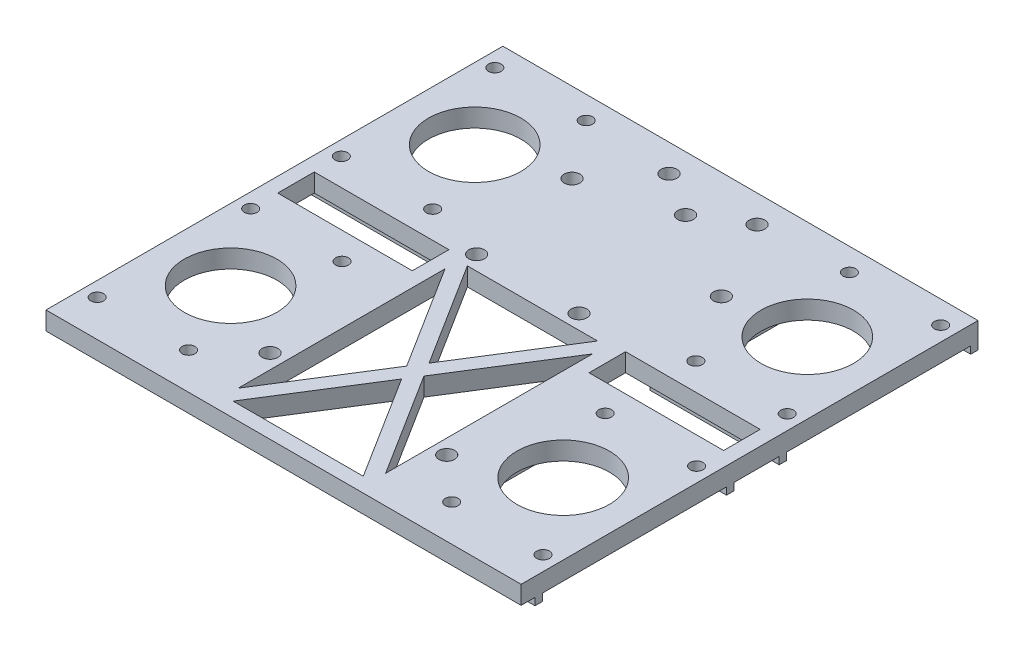
from build123d import *

# Parameters (mm, degrees)
SKETCH1_W                 = 130
SKETCH1_H                 = 125
BOSS_EXTRUDE1_DEPTH       = 5
SKETCH2_R                 = 1.75
SKETCH2_R_2               = 12.65
CUT_EXTRUDE1_DEPTH        = 10
SKETCH4_R                 = 2.15
CUT_EXTRUDE3_DEPTH        = 10
BOSS_EXTRUDE2_DEPTH       = 2
MIRROR7_COPY_1_SKETCH_R   = 1.75
MIRROR7_COPY_1_SKETCH_R_2 = 12.65
MIRROR7_COPY_1_DEPTH      = 10
MIRROR7_COPY_2_DEPTH      = 2
SKETCH10_R                = 2.15
CUT_EXTRUDE8_DEPTH        = 91.311959341
SKETCH11_R                = 2.65
CUT_EXTRUDE9_DEPTH        = 0.5
CUT_EXTRUDE10_DEPTH       = 91.444734507
CUT_EXTRUDE11_DEPTH       = 91.444734507


with BuildPart() as part:
    # Sketch1 → Boss-Extrude1 (new body)
    with BuildSketch(Plane(origin=(0, 0, 0), x_dir=(1, 0, 0), z_dir=(0, 1, 0))):
        Rectangle(SKETCH1_W, SKETCH1_H)
    extrude(amount=BOSS_EXTRUDE1_DEPTH)

    # Sketch2 → Cut-Extrude1 (cut)
    with BuildSketch(Plane(origin=(0, 5, 0), x_dir=(1, 0, 0), z_dir=(0, 1, 0))):
        with Locations(Location((-61, -52.5, 0), (0, 0, 270))):
            Circle(SKETCH2_R)
        with Locations(Location((-36, -52.5, 0), (0, 0, 270))):
            Circle(SKETCH2_R)
        with Locations(Location((-36, -10.5, 0), (0, 0, 270))):
            Circle(SKETCH2_R)
        with Locations(Location((-61, -10.5, 0), (0, 0, 270))):
            Circle(SKETCH2_R)
        with Locations(Location((-45.5, -31.5, 0), (0, 0, 270))):
            Circle(SKETCH2_R_2)
    cut_extrude1 = extrude(amount=-CUT_EXTRUDE1_DEPTH, mode=Mode.SUBTRACT)

    # Mirror3: Cut-Extrude1 across plane
    add(cut_extrude1.mirror(Plane.ZY), mode=Mode.SUBTRACT)

    # Sketch4 → Cut-Extrude3 (cut)
    with BuildSketch(Plane(origin=(0, 5, 0), x_dir=(1, 0, 0), z_dir=(0, 1, 0))):
        with Locations(Location((0, 47.5, 0), (0, 0, 270))):
            Circle(SKETCH4_R)
        with Locations(Location((12.049810205, 55, 0), (0, 0, 270))):
            Circle(SKETCH4_R)
        with Locations(Location((-12.049810205, 55, 0), (0, 0, 270))):
            Circle(SKETCH4_R)
    extrude(amount=-CUT_EXTRUDE3_DEPTH, mode=Mode.SUBTRACT)

    # Sketch5 → Boss-Extrude2 (add)
    with BuildSketch(Plane.XZ):
        Polygon((-65, 58.7), (-65, 56.7), (-31.6, 56.7), (-31.6, 6.3), (-65, 6.3), (-65, 4.3), (-29.6, 4.3), (-29.6, 58.7), align=None)
    boss_extrude2 = extrude(amount=BOSS_EXTRUDE2_DEPTH)

    # Mirror5: Boss-Extrude2 across plane
    add(boss_extrude2.mirror(Plane.ZY))

    # Mirror7: Cut-Extrude1, Boss-Extrude2 across plane
    add(cut_extrude1.mirror(Plane.XY.offset(-1.9)), mode=Mode.SUBTRACT)
    add(boss_extrude2.mirror(Plane.XY.offset(-1.9)))

    # Mirror7 copy 1 sketch → Mirror7 copy 1 (cut)
    with BuildSketch(Plane(origin=(0, 5, -3.8), x_dir=(-1, 0, 0), z_dir=(0, 1, 0))):
        with Locations(Location((-61, -52.5, 0), (0, 0, 270))):
            Circle(MIRROR7_COPY_1_SKETCH_R)
        with Locations(Location((-36, -52.5, 0), (0, 0, 270))):
            Circle(MIRROR7_COPY_1_SKETCH_R)
        with Locations(Location((-36, -10.5, 0), (0, 0, 270))):
            Circle(MIRROR7_COPY_1_SKETCH_R)
        with Locations(Location((-61, -10.5, 0), (0, 0, 270))):
            Circle(MIRROR7_COPY_1_SKETCH_R)
        with Locations(Location((-45.5, -31.5, 0), (0, 0, 270))):
            Circle(MIRROR7_COPY_1_SKETCH_R_2)
    extrude(amount=-MIRROR7_COPY_1_DEPTH, mode=Mode.SUBTRACT)

    # Mirror7 copy 2 sketch → Mirror7 copy 2 (add)
    with BuildSketch(Plane(origin=(0, 0, -3.8), x_dir=(-1, 0, 0), z_dir=(0, -1, 0))):
        Polygon((-65, 58.7), (-65, 56.7), (-31.6, 56.7), (-31.6, 6.3), (-65, 6.3), (-65, 4.3), (-29.6, 4.3), (-29.6, 58.7), align=None)
    extrude(amount=MIRROR7_COPY_2_DEPTH)

    # Sketch10 → Cut-Extrude8 (cut, through all)
    with BuildSketch(Plane(origin=(0, 0, 0), x_dir=(-1, 0, 0), z_dir=(0, -1, 0))):
        with Locations(Location((-24.17, -42.03, 0), (0, 0, 90))):
            Circle(SKETCH10_R)
        with Locations(Location((24.17, -42.03, 0), (0, 0, 90))):
            Circle(SKETCH10_R)
        with Locations(Location((-8.73, 9.6, 0), (0, 0, 90))):
            Circle(SKETCH10_R)
        with Locations(Location((19.29, 9.6, 0), (0, 0, 90))):
            Circle(SKETCH10_R)
        with Locations(Location((-24.17, 33.11, 0), (0, 0, 90))):
            Circle(SKETCH10_R)
        with Locations(Location((24.17, 40.6, 0), (0, 0, 90))):
            Circle(SKETCH10_R)
    extrude(amount=-CUT_EXTRUDE8_DEPTH, mode=Mode.SUBTRACT)

    # Sketch11 → Cut-Extrude9 (cut)
    with BuildSketch(Plane.XZ):
        with Locations(Location((-12.049810205, -55, 0), (0, 0, 270))):
            Circle(SKETCH11_R)
        with Locations(Location((0, -47.5, 0), (0, 0, 270))):
            Circle(SKETCH11_R)
        with Locations(Location((12.049810205, -55, 0), (0, 0, 270))):
            Circle(SKETCH11_R)
        with Locations(Location((-24.17, -40.6, 0), (0, 0, 270))):
            Circle(SKETCH11_R)
        with Locations(Location((24.17, -33.11, 0), (0, 0, 270))):
            Circle(SKETCH11_R)
        with Locations(Location((8.73, -9.6, 0), (0, 0, 270))):
            Circle(SKETCH11_R)
        with Locations(Location((-19.29, -9.6, 0), (0, 0, 270))):
            Circle(SKETCH11_R)
        with Locations(Location((-24.17, 42.03, 0), (0, 0, 270))):
            Circle(SKETCH11_R)
        with Locations(Location((24.17, 42.03, 0), (0, 0, 270))):
            Circle(SKETCH11_R)
        with Locations(Location((-61, -14.3, 0), (0, 0, 270))):
            Circle(SKETCH11_R)
        with Locations(Location((-36, -14.3, 0), (0, 0, 270))):
            Circle(SKETCH11_R)
        with Locations(Location((-61, -56.3, 0), (0, 0, 270))):
            Circle(SKETCH11_R)
        with Locations(Location((-36, -56.3, 0), (0, 0, 270))):
            Circle(SKETCH11_R)
        with Locations(Location((36, -56.3, 0), (0, 0, 270))):
            Circle(SKETCH11_R)
        with Locations(Location((61, -56.3, 0), (0, 0, 270))):
            Circle(SKETCH11_R)
        with Locations(Location((36, -14.3, 0), (0, 0, 270))):
            Circle(SKETCH11_R)
        with Locations(Location((61, -14.3, 0), (0, 0, 270))):
            Circle(SKETCH11_R)
        with Locations(Location((36, 10.5, 0), (0, 0, 270))):
            Circle(SKETCH11_R)
        with Locations(Location((61, 10.5, 0), (0, 0, 270))):
            Circle(SKETCH11_R)
        with Locations(Location((61, 52.5, 0), (0, 0, 270))):
            Circle(SKETCH11_R)
        with Locations(Location((36, 52.5, 0), (0, 0, 270))):
            Circle(SKETCH11_R)
        with Locations(Location((-36, 52.5, 0), (0, 0, 270))):
            Circle(SKETCH11_R)
        with Locations(Location((-36, 10.5, 0), (0, 0, 270))):
            Circle(SKETCH11_R)
        with Locations(Location((-61, 10.5, 0), (0, 0, 270))):
            Circle(SKETCH11_R)
        with Locations(Location((-61, 52.5, 0), (0, 0, 270))):
            Circle(SKETCH11_R)
    extrude(amount=-CUT_EXTRUDE9_DEPTH, mode=Mode.SUBTRACT)

    # Sketch12 → Cut-Extrude10 (cut, through all)
    with BuildSketch(Plane(origin=(0, 5, 0), x_dir=(1, 0, 0), z_dir=(0, 1, 0))):
        Polygon((-2.363095604, -26.45), (-20.17, 1.845056316), (-20.17, -54.745056316), align=None)
        Polygon((17.806904396, 5.6), (-17.806904396, 5.6), (0, -22.695056316), align=None)
        Polygon((20.17, -54.745056316), (20.17, 1.845056316), (2.363095604, -26.45), align=None)
        Polygon((0, -30.204943684), (-17.806904396, -58.5), (17.806904396, -58.5), align=None)
    extrude(amount=-CUT_EXTRUDE10_DEPTH, mode=Mode.SUBTRACT)

    # Sketch13 → Cut-Extrude11 (cut, through all)
    with BuildSketch(Plane(origin=(0, 5, 0), x_dir=(1, 0, 0), z_dir=(0, 1, 0))):
        Polygon((-61, 1.9), (-61, -3.1), (-24.17, -3.1), (-24.17, 6.9), (-61, 6.9), align=None)
    cut_extrude11 = extrude(amount=-CUT_EXTRUDE11_DEPTH, mode=Mode.SUBTRACT)

    # Mirror9: Cut-Extrude11 across plane
    add(cut_extrude11.mirror(Plane.ZY), mode=Mode.SUBTRACT)


solid = part.part
